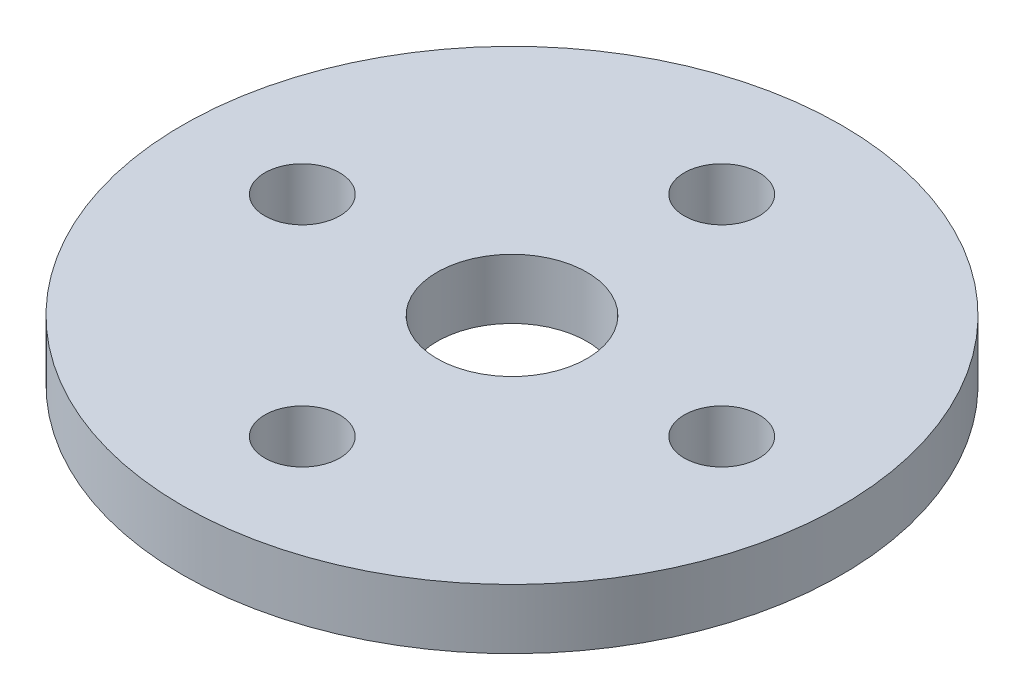
from build123d import *

# Parameters (mm, degrees)
SKETCH1_R           = 11
SKETCH1_R_2         = 2.5
SKETCH1_R_3         = 1.25
BOSS_EXTRUDE1_DEPTH = 3
CUT_EXTRUDE1_START  = -1
SKETCH2_R           = 11
CUT_EXTRUDE1_DEPTH  = 1


with BuildPart() as part:
    # Sketch1 → Boss-Extrude1 (new body)
    with BuildSketch(Plane(origin=(0, 0, 0), x_dir=(1, 0, 0), z_dir=(0, 1, 0))):
        with Locations(Location((0, 0, 0), (0, 0, 270))):
            Circle(SKETCH1_R)
        with Locations(Location((0, 0, 0), (0, 0, 270))):
            Circle(SKETCH1_R_2, mode=Mode.SUBTRACT)
        with Locations(Location((0, 7, 0), (0, 0, 270))):
            Circle(SKETCH1_R_3, mode=Mode.SUBTRACT)
        with Locations(Location((7, 0, 0), (0, 0, 270))):
            Circle(SKETCH1_R_3, mode=Mode.SUBTRACT)
        with Locations(Location((0, -7, 0), (0, 0, 270))):
            Circle(SKETCH1_R_3, mode=Mode.SUBTRACT)
        with Locations(Location((-7, 0, 0), (0, 0, 270))):
            Circle(SKETCH1_R_3, mode=Mode.SUBTRACT)
    extrude(amount=BOSS_EXTRUDE1_DEPTH)

    # Sketch2 → Cut-Extrude1 (cut)
    with BuildSketch(Plane(origin=(0, 3, 0), x_dir=(1, 0, 0), z_dir=(0, 1, 0)).offset(CUT_EXTRUDE1_START)):
        with Locations(Location((0, 0, 0), (0, 0, 270))):
            Circle(SKETCH2_R)
    extrude(amount=CUT_EXTRUDE1_DEPTH, mode=Mode.SUBTRACT)


solid = part.part
